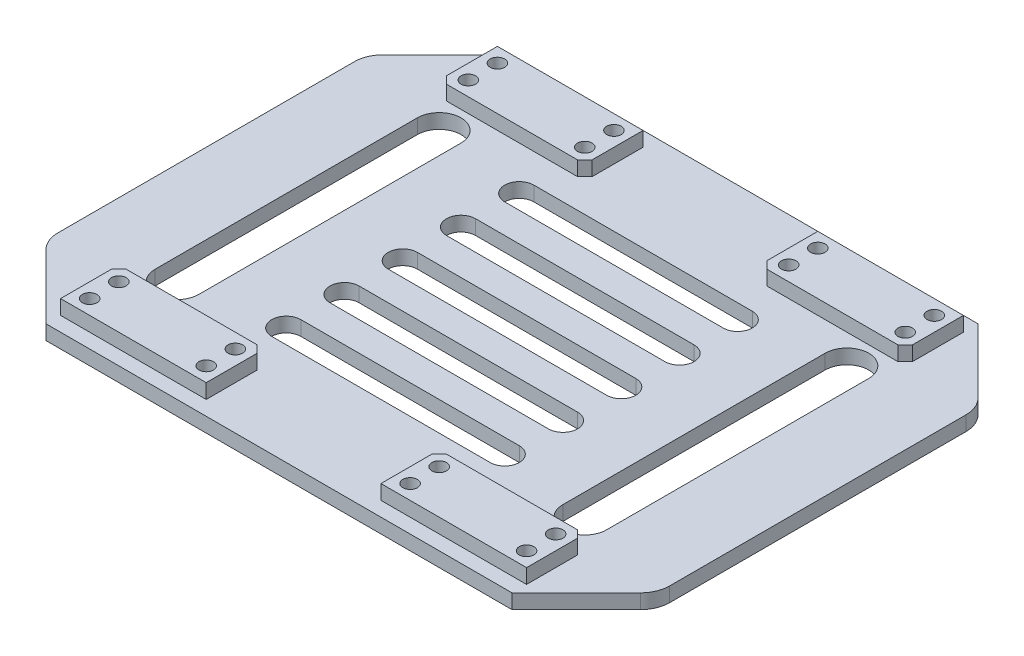
from build123d import *

# Parameters (mm, degrees)
SKETCH1_R               = 18.5
BOSS_EXTRUDE1_DEPTH     = 22.5
SKETCH2_R               = 1.6
CUT_EXTRUDE1_DEPTH      = 3.5
BOSS_EXTRUDE2_DEPTH     = 36.3
BOSS_EXTRUDE3_DEPTH     = 6.3
SKETCH4_R               = 14.5
BOSS_EXTRUDE4_DEPTH     = 37.8
SKETCH5_R               = 5
BOSS_EXTRUDE5_DEPTH     = 3
SKETCH6_R               = 1
BOSS_EXTRUDE6_DEPTH     = 9
SKETCH7_W               = 0.5
SKETCH7_H               = 3
BOSS_EXTRUDE7_DEPTH     = 6.5
CUT_EXTRUDE2_DEPTH      = 0.5
FILLET1_R               = 0.5
CHAMFER1_SIZE           = 0.2
CUT_EXTRUDE3_DEPTH      = 67.7078706
CUT_EXTRUDE3_DEPTH_BACK = 67.7078706
SKETCH9_R               = 1.6
SKETCH10_R              = 1.6
BOSS_EXTRUDE8_DEPTH     = 10
BOSS_EXTRUDE8_2_DEPTH   = 10
BOSS_EXTRUDE8_3_DEPTH   = 10
BOSS_EXTRUDE8_4_DEPTH   = 10
BOSS_EXTRUDE8_5_DEPTH   = 10
BOSS_EXTRUDE8_6_DEPTH   = 10
SKETCH11_W              = 50
SKETCH11_H              = 60
BOSS_EXTRUDE9_DEPTH     = 5
SKETCH13_W              = 56.82563108
SKETCH13_H              = 53.984349526
CUT_EXTRUDE4_DEPTH      = 121
CUT_EXTRUDE5_DEPTH      = 54.194830576
CUT_EXTRUDE5_DEPTH_BACK = 54.194830576
SKETCH14_R              = 1.6
SKETCH14_R_2            = 6
SKETCH15_W              = 160
SKETCH15_H              = 160
BOSS_EXTRUDE10_DEPTH    = 5
CHAMFER2_SIZE           = 2.5
CHAMFER3_SIZE           = 2.5
CUT_EXTRUDE6_DEPTH      = 237.127613802
SKETCH19_W              = 25
SKETCH19_H              = 160
BOSS_EXTRUDE11_DEPTH    = 5
CHAMFER4_SIZE           = 25
SKETCH20_R              = 12.5
SKETCH20_R_2            = 7.5
CUT_EXTRUDE7_DEPTH      = 10
CHAMFER5_SIZE           = 2.5
CHAMFER6_SIZE           = 2.5
FILLET2_R               = 10
BOSS_EXTRUDE12_START    = -5
SKETCH21_W              = 50
SKETCH21_H              = 20
SKETCH21_R              = 2.5
BOSS_EXTRUDE12_DEPTH    = 5
CHAMFER7_SIZE           = 2.5
SKETCH22_R              = 2.5
BOSS_EXTRUDE13_DEPTH    = 5
SKETCH23_W              = 231.350746522
SKETCH23_H              = 96.020227026
CUT_EXTRUDE8_DEPTH      = 212
SKETCH22_3_R            = 2.5
BOSS_EXTRUDE14_DEPTH    = 5
CUT_EXTRUDE9_DEPTH      = 243.757595144
CUT_EXTRUDE9_DEPTH_BACK = 243.757595144


with BuildPart() as part:
    # Sketch1 → Boss-Extrude1 (new body)
    with BuildSketch(Plane.XY):
        with Locations(Location((0, 0, 0), (0, 0, 180))):
            Circle(SKETCH1_R)
    extrude(amount=BOSS_EXTRUDE1_DEPTH)

    # Sketch2 → Cut-Extrude1 (cut)
    with BuildSketch(Plane.XY.offset(22.5)):
        with Locations((-7.75, 13.423393759)):
            Circle(SKETCH2_R)
        with Locations((7.75, 13.423393759)):
            Circle(SKETCH2_R)
        with Locations((-15.5, 0)):
            Circle(SKETCH2_R)
        with Locations((-7.75, -13.423393759)):
            Circle(SKETCH2_R)
        with Locations((7.75, -13.423393759)):
            Circle(SKETCH2_R)
        with Locations((15.5, 0)):
            Circle(SKETCH2_R)
    extrude(amount=-CUT_EXTRUDE1_DEPTH, mode=Mode.SUBTRACT)

    # Sketch3 → Boss-Extrude2 (add)
    with BuildSketch(Plane.XY.offset(22.5)):
        with BuildLine():
            ThreePointArc((0, 10), (-3, 7), (0, 4))
            Line((0, 4), (0, 10))
        make_face()
        with BuildLine():
            Line((0, 10), (0, 4))
            ThreePointArc((0, 4), (2.121320344, 4.878679656), (3, 7))
            ThreePointArc((3, 7), (2.121320344, 9.121320344), (0, 10))
        make_face()
    extrude(amount=BOSS_EXTRUDE2_DEPTH)

    # Sketch3<3> → Boss-Extrude3 (add)
    with BuildSketch(Plane.XY.offset(22.5)):
        with BuildLine():
            ThreePointArc((0, 13), (-6, 7), (0, 1))
            Line((0, 1), (0, 4))
            ThreePointArc((0, 4), (-3, 7), (0, 10))
            Line((0, 10), (0, 13))
        make_face()
        with BuildLine():
            Line((0, 4), (0, 1))
            ThreePointArc((0, 1), (4.242640687, 2.757359313), (6, 7))
            ThreePointArc((6, 7), (4.242640687, 11.242640687), (0, 13))
            Line((0, 13), (0, 10))
            ThreePointArc((0, 10), (2.121320344, 9.121320344), (3, 7))
            ThreePointArc((3, 7), (2.121320344, 4.878679656), (0, 4))
        make_face()
    extrude(amount=BOSS_EXTRUDE3_DEPTH)

    # Sketch4 → Boss-Extrude4 (add)
    with BuildSketch(Plane(origin=(0, 0, 0), x_dir=(-1, 0, 0), z_dir=(0, 0, -1))):
        with Locations(Location((0, 0, 0), (0, 0, 180))):
            Circle(SKETCH4_R)
    extrude(amount=BOSS_EXTRUDE4_DEPTH)

    # Sketch5 → Boss-Extrude5 (add)
    with BuildSketch(Plane(origin=(0, 0, -37.8), x_dir=(-1, 0, 0), z_dir=(0, 0, -1))):
        Circle(SKETCH5_R)
    extrude(amount=BOSS_EXTRUDE5_DEPTH)

    # Sketch6 → Boss-Extrude6 (add)
    with BuildSketch(Plane(origin=(0, 0, -40.8), x_dir=(-1, 0, 0), z_dir=(0, 0, -1))):
        Circle(SKETCH6_R)
    extrude(amount=BOSS_EXTRUDE6_DEPTH)

    # Sketch7 → Boss-Extrude7 (add)
    with BuildSketch(Plane(origin=(0, 0, -37.8), x_dir=(-1, 0, 0), z_dir=(0, 0, -1))):
        with Locations((-11.75, 0)):
            Rectangle(SKETCH7_W, SKETCH7_H)
        with Locations((11.75, 0)):
            Rectangle(SKETCH7_W, SKETCH7_H)
    extrude(amount=BOSS_EXTRUDE7_DEPTH)

    # Sketch8 → Cut-Extrude2 (cut)
    with BuildSketch(Plane(origin=(12, 0, 0), x_dir=(0, 0, -1), z_dir=(1, 0, 0))):
        with BuildLine():
            Line((42.865122037, -0.320114275), (41.665122037, -0.320114275))
            ThreePointArc((41.665122037, -0.320114275), (41.345007763, 0), (41.665122037, 0.320114275))
            Line((41.665122037, 0.320114275), (42.865122037, 0.320114275))
            ThreePointArc((42.865122037, 0.320114275), (43.185236312, 0), (42.865122037, -0.320114275))
        make_face()
    cut_extrude2 = extrude(amount=-CUT_EXTRUDE2_DEPTH, mode=Mode.SUBTRACT)

    # Mirror2: Cut-Extrude2 across plane
    add(cut_extrude2.mirror(Plane(origin=(0, 0, 0), x_dir=(0, 0, 1), z_dir=(1, 0, 0))), mode=Mode.SUBTRACT)

    # Fillet1
    fillet1_edges = [part.edges().sort_by_distance(p)[0] for p in [
        (11.75, -1.5, -44.3),
        (11.75, 1.5, -44.3),
        (-11.75, 1.5, -44.3),
        (-11.75, -1.5, -44.3),
    ]]
    fillet(fillet1_edges, radius=FILLET1_R)

    # Chamfer1
    chamfer1_edges = [part.edges().sort_by_distance(p)[0] for p in [
        (0, 4, 58.8),
        (0, 1, 28.8),
        (18.5, 0, 22.5),
    ]]
    chamfer(chamfer1_edges, length=CHAMFER1_SIZE)

    # Sketch9 → Cut-Extrude3 (cut, two sides: drawn at the far end of the back side and taken through both)
    with BuildSketch(Plane(origin=(0, 7, 0), x_dir=(1, 0, 0), z_dir=(0, 1, 0)).offset(-CUT_EXTRUDE3_DEPTH_BACK)):
        with Locations(Location((0, -50.8, 0), (0, 0, 270))):
            Circle(SKETCH9_R)
    extrude(amount=CUT_EXTRUDE3_DEPTH + CUT_EXTRUDE3_DEPTH_BACK, mode=Mode.SUBTRACT)



with BuildPart() as body_2:
    # Sketch10 → Boss-Extrude8 (new body)
    with BuildSketch(Plane.XY.offset(22.5)):
        with Locations((-7.75, 13.423393759)):
            Circle(SKETCH10_R)
    extrude(amount=BOSS_EXTRUDE8_DEPTH)


with BuildPart() as body_3:
    # Sketch10 → Boss-Extrude8 2 (new body)
    with BuildSketch(Plane.XY.offset(22.5)):
        with Locations((-15.5, 0)):
            Circle(SKETCH10_R)
    extrude(amount=BOSS_EXTRUDE8_2_DEPTH)


with BuildPart() as body_4:
    # Sketch10 → Boss-Extrude8 3 (new body)
    with BuildSketch(Plane.XY.offset(22.5)):
        with Locations((-7.75, -13.423393759)):
            Circle(SKETCH10_R)
    extrude(amount=BOSS_EXTRUDE8_3_DEPTH)


with BuildPart() as body_5:
    # Sketch10 → Boss-Extrude8 4 (new body)
    with BuildSketch(Plane.XY.offset(22.5)):
        with Locations((7.75, -13.423393759)):
            Circle(SKETCH10_R)
    extrude(amount=BOSS_EXTRUDE8_4_DEPTH)


with BuildPart() as body_6:
    # Sketch10 → Boss-Extrude8 5 (new body)
    with BuildSketch(Plane.XY.offset(22.5)):
        with Locations((15.5, 0)):
            Circle(SKETCH10_R)
    extrude(amount=BOSS_EXTRUDE8_5_DEPTH)


with BuildPart() as body_7:
    # Sketch10 → Boss-Extrude8 6 (new body)
    with BuildSketch(Plane.XY.offset(22.5)):
        with Locations((7.75, 13.423393759)):
            Circle(SKETCH10_R)
    extrude(amount=BOSS_EXTRUDE8_6_DEPTH)


with BuildPart() as part_1:
    add(part.part)

    add(body_2.part)  # Boss-Extrude9 merges body 2

    add(body_3.part)  # Boss-Extrude9 merges body 3

    add(body_4.part)  # Boss-Extrude9 merges body 4

    add(body_5.part)  # Boss-Extrude9 merges body 5

    add(body_6.part)  # Boss-Extrude9 merges body 6

    add(body_7.part)  # Boss-Extrude9 merges body 7
    # Sketch11 → Boss-Extrude9 (add)
    with BuildSketch(Plane.XY.offset(22.5)):
        with Locations((0, -5)):
            Rectangle(SKETCH11_W, SKETCH11_H)
    extrude(amount=BOSS_EXTRUDE9_DEPTH)

    # Sketch13 → Cut-Extrude4 (cut)
    with BuildSketch(Plane(origin=(0, 0, 22.5), x_dir=(-1, 0, 0), z_dir=(0, 0, -1))):
        with Locations((0.725433588, -0.664980789)):
            Rectangle(SKETCH13_W, SKETCH13_H)
    extrude(amount=CUT_EXTRUDE4_DEPTH, mode=Mode.SUBTRACT)

    # Sketch14 → Cut-Extrude5 (cut, two sides: drawn at the far end of the back side and taken through both)
    with BuildSketch(Plane.XY.offset(27.5).offset(-CUT_EXTRUDE5_DEPTH_BACK)):
        with Locations((-7.75, 13.423393759)):
            Circle(SKETCH14_R)
        with Locations((7.75, 13.423393759)):
            Circle(SKETCH14_R)
        with Locations((-15.5, 0)):
            Circle(SKETCH14_R)
        with Locations((-7.75, -13.423393759)):
            Circle(SKETCH14_R)
        with Locations((7.75, -13.423393759)):
            Circle(SKETCH14_R)
        with Locations((15.5, 0)):
            Circle(SKETCH14_R)
        with Locations((0, 7)):
            Circle(SKETCH14_R_2)
    extrude(amount=CUT_EXTRUDE5_DEPTH + CUT_EXTRUDE5_DEPTH_BACK, mode=Mode.SUBTRACT)

    # Sketch15 → Boss-Extrude10 (add)
    with BuildSketch(Plane(origin=(0, 25, 0), x_dir=(1, 0, 0), z_dir=(0, 1, 0))):
        with Locations((55, -102.5)):
            Rectangle(SKETCH15_W, SKETCH15_H)
    extrude(amount=BOSS_EXTRUDE10_DEPTH)

    # Mirror3: part across plane


with BuildPart() as part_2:
    add(part_1.part)
    add(part_1.part.mirror(Plane.XY.offset(102.5)))

    # Mirror11: part across plane


with BuildPart() as part_3:
    add(part_2.part)
    add(part_2.part.mirror(Plane(origin=(55, 0, 0), x_dir=(0, 0, 1), z_dir=(1, 0, 0))))

    # Chamfer2
    chamfer2_edges = [part_3.edges().sort_by_distance(p)[0] for p in [
        (25, 25, 25),
        (25, 25, 180),
        (85, 25, 25),
    ]]
    chamfer(chamfer2_edges, length=CHAMFER2_SIZE)

    # Chamfer3
    chamfer3_edges = [part_3.edges().sort_by_distance(p)[0] for p in [
        (85, 25, 180),
    ]]
    chamfer(chamfer3_edges, length=CHAMFER3_SIZE)

    # Sketch18 → Cut-Extrude6 (cut, through all)
    with BuildSketch(Plane(origin=(0, 30, 0), x_dir=(1, 0, 0), z_dir=(0, 1, 0))):
        with BuildLine():
            Line((92.5, -47.5), (17.5, -47.5))
            ThreePointArc((17.5, -47.5), (12.5, -42.5), (17.5, -37.5))
            Line((17.5, -37.5), (92.5, -37.5))
            ThreePointArc((92.5, -37.5), (97.5, -42.5), (92.5, -47.5))
        make_face()
        with BuildLine():
            Line((17.5, -57.5), (92.5, -57.5))
            ThreePointArc((92.5, -57.5), (97.5, -62.5), (92.5, -67.5))
            Line((92.5, -67.5), (17.5, -67.5))
            ThreePointArc((17.5, -67.5), (12.5, -62.5), (17.5, -57.5))
        make_face()
        with BuildLine():
            Line((17.5, -77.5), (92.5, -77.5))
            ThreePointArc((92.5, -77.5), (97.5, -82.5), (92.5, -87.5))
            Line((92.5, -87.5), (17.5, -87.5))
            ThreePointArc((17.5, -87.5), (12.5, -82.5), (17.5, -77.5))
        make_face()
        with BuildLine():
            Line((17.5, -97.5), (92.5, -97.5))
            ThreePointArc((92.5, -97.5), (97.5, -102.5), (92.5, -107.5))
            Line((92.5, -107.5), (17.5, -107.5))
            ThreePointArc((17.5, -107.5), (12.5, -102.5), (17.5, -97.5))
        make_face()
        with BuildLine():
            Line((17.5, -117.5), (92.5, -117.5))
            ThreePointArc((92.5, -117.5), (97.5, -122.5), (92.5, -127.5))
            Line((92.5, -127.5), (17.5, -127.5))
            ThreePointArc((17.5, -127.5), (12.5, -122.5), (17.5, -117.5))
        make_face()
        with BuildLine():
            Line((17.5, -137.5), (92.5, -137.5))
            ThreePointArc((92.5, -137.5), (97.5, -142.5), (92.5, -147.5))
            Line((92.5, -147.5), (17.5, -147.5))
            ThreePointArc((17.5, -147.5), (12.5, -142.5), (17.5, -137.5))
        make_face()
        with BuildLine():
            Line((92.5, -167.5), (17.5, -167.5))
            ThreePointArc((17.5, -167.5), (12.5, -162.5), (17.5, -157.5))
            Line((17.5, -157.5), (92.5, -157.5))
            ThreePointArc((92.5, -157.5), (97.5, -162.5), (92.5, -167.5))
        make_face()
    extrude(amount=-CUT_EXTRUDE6_DEPTH, mode=Mode.SUBTRACT)

    # Sketch19 → Boss-Extrude11 (add)
    with BuildSketch(Plane(origin=(0, 30, 0), x_dir=(1, 0, 0), z_dir=(0, 1, 0))):
        with Locations((-37.5, -102.5)):
            Rectangle(SKETCH19_W, SKETCH19_H)
        with Locations((147.5, -102.5)):
            Rectangle(SKETCH19_W, SKETCH19_H)
    extrude(amount=-BOSS_EXTRUDE11_DEPTH)

    # Chamfer4
    chamfer4_edges = [part_3.edges().sort_by_distance(p)[0] for p in [
        (-50, 27.5, 22.5),
        (-50, 27.5, 182.5),
        (160, 27.5, 182.5),
        (160, 27.5, 22.5),
    ]]
    chamfer(chamfer4_edges, length=CHAMFER4_SIZE)

    # Sketch20 → Cut-Extrude7 (cut)
    with BuildSketch(Plane(origin=(0, 30, 0), x_dir=(1, 0, 0), z_dir=(0, 1, 0))):
        with Locations(Location((130, -102.5, 0), (0, 0, 270))):
            Circle(SKETCH20_R)
        with Locations(Location((130, -62.5, 0), (0, 0, 270))):
            Circle(SKETCH20_R_2)
        with Locations(Location((130, -142.5, 0), (0, 0, 270))):
            Circle(SKETCH20_R_2)
        with Locations(Location((-20, -142.5, 0), (0, 0, 270))):
            Circle(SKETCH20_R_2)
        with Locations(Location((-20, -102.5, 0), (0, 0, 270))):
            Circle(SKETCH20_R)
        with Locations(Location((-20, -62.5, 0), (0, 0, 270))):
            Circle(SKETCH20_R_2)
    extrude(amount=-CUT_EXTRUDE7_DEPTH, mode=Mode.SUBTRACT)

    # Chamfer5
    chamfer5_edges = [part_3.edges().sort_by_distance(p)[0] for p in [
        (108.75, 25, 177.5),
        (1.25, 25, 177.5),
        (1.25, 25, 27.5),
        (108.75, 25, 27.5),
    ]]
    chamfer(chamfer5_edges, length=CHAMFER5_SIZE)

    # Chamfer6
    chamfer6_edges = [part_3.edges().sort_by_distance(p)[0] for p in [
        (135, 25, 178.75),
        (135, 25, 26.25),
        (-25, 25, 26.25),
        (-25, 25, 178.75),
    ]]
    chamfer(chamfer6_edges, length=CHAMFER6_SIZE)

    # Fillet2
    fillet2_edges = [part_3.edges().sort_by_distance(p)[0] for p in [
        (-50, 27.5, 157.5),
        (-50, 27.5, 47.5),
        (160, 27.5, 47.5),
        (160, 27.5, 157.5),
    ]]
    fillet(fillet2_edges, radius=FILLET2_R)

    # Sketch21 → Boss-Extrude12 (add)
    # profile 1 of 4: a face of its own
    with BuildSketch(Plane.XZ.offset(35).offset(BOSS_EXTRUDE12_START)):
        with Locations((110, 37.5)):
            Rectangle(SKETCH21_W, SKETCH21_H)
        with Locations(Location((90, 32.5, 0), (0, 0, 270))):
            Circle(SKETCH21_R, mode=Mode.SUBTRACT)
        with Locations(Location((90, 42.5, 0), (0, 0, 270))):
            Circle(SKETCH21_R, mode=Mode.SUBTRACT)
        with Locations(Location((130, 32.5, 0), (0, 0, 90))):
            Circle(SKETCH21_R, mode=Mode.SUBTRACT)
        with Locations(Location((130, 42.5, 0), (0, 0, 90))):
            Circle(SKETCH21_R, mode=Mode.SUBTRACT)
    # profile 2 of 4: a face of its own
    with BuildSketch(Plane.XZ.offset(35).offset(BOSS_EXTRUDE12_START)):
        with Locations((110, 167.5)):
            Rectangle(SKETCH21_W, SKETCH21_H)
        with Locations(Location((90, 162.5, 0), (0, 0, 90))):
            Circle(SKETCH21_R, mode=Mode.SUBTRACT)
        with Locations(Location((90, 172.5, 0), (0, 0, 90))):
            Circle(SKETCH21_R, mode=Mode.SUBTRACT)
        with Locations(Location((130, 172.5, 0), (0, 0, 270))):
            Circle(SKETCH21_R, mode=Mode.SUBTRACT)
        with Locations(Location((130, 162.5, 0), (0, 0, 270))):
            Circle(SKETCH21_R, mode=Mode.SUBTRACT)
    # profile 3 of 4: a face of its own
    with BuildSketch(Plane.XZ.offset(35).offset(BOSS_EXTRUDE12_START)):
        with Locations((0, 167.5)):
            Rectangle(SKETCH21_W, SKETCH21_H)
        with Locations(Location((-20, 162.5, 0), (0, 0, 90))):
            Circle(SKETCH21_R, mode=Mode.SUBTRACT)
        with Locations(Location((-20, 172.5, 0), (0, 0, 90))):
            Circle(SKETCH21_R, mode=Mode.SUBTRACT)
        with Locations(Location((20, 172.5, 0), (0, 0, 270))):
            Circle(SKETCH21_R, mode=Mode.SUBTRACT)
        with Locations(Location((20, 162.5, 0), (0, 0, 270))):
            Circle(SKETCH21_R, mode=Mode.SUBTRACT)
    # profile 4 of 4: a face of its own
    with BuildSketch(Plane.XZ.offset(35).offset(BOSS_EXTRUDE12_START)):
        with Locations((0, 37.5)):
            Rectangle(SKETCH21_W, SKETCH21_H)
        with Locations(Location((-20, 32.5, 0), (0, 0, 270))):
            Circle(SKETCH21_R, mode=Mode.SUBTRACT)
        with Locations(Location((-20, 42.5, 0), (0, 0, 270))):
            Circle(SKETCH21_R, mode=Mode.SUBTRACT)
        with Locations(Location((20, 32.5, 0), (0, 0, 90))):
            Circle(SKETCH21_R, mode=Mode.SUBTRACT)
        with Locations(Location((20, 42.5, 0), (0, 0, 90))):
            Circle(SKETCH21_R, mode=Mode.SUBTRACT)
    extrude(amount=-BOSS_EXTRUDE12_DEPTH)

    # Chamfer7
    chamfer7_edges = [part_3.edges().sort_by_distance(p)[0] for p in [
        (85, -27.5, 47.5),
        (135, -27.5, 47.5),
        (85, -27.5, 157.5),
        (135, -27.5, 157.5),
        (25, -27.5, 157.5),
        (-25, -27.5, 157.5),
        (-25, -27.5, 47.5),
        (25, -27.5, 47.5),
    ]]
    chamfer(chamfer7_edges, length=CHAMFER7_SIZE)

    # Sketch23 → Cut-Extrude8 (cut)
    with BuildSketch(Plane(origin=(0, 0, 22.5), x_dir=(-1, 0, 0), z_dir=(0, 0, -1))):
        with Locations((-44.324626739, 13.010113513)):
            Rectangle(SKETCH23_W, SKETCH23_H)
    extrude(amount=-CUT_EXTRUDE8_DEPTH, mode=Mode.SUBTRACT)


with BuildPart() as body_2_2:
    # Sketch22 → Boss-Extrude13 (new body)
    with BuildSketch(Plane.XZ.offset(35)):
        with BuildLine():
            Line((-25, 182.5), (-47.071067812, 160.428932188))
            ThreePointArc((-47.071067812, 160.428932188), (-49.238795325, 157.1846987), (-50, 153.357864376))
            Line((-50, 153.357864376), (-50, 51.642135624))
            ThreePointArc((-50, 51.642135624), (-49.238795325, 47.8153013), (-47.071067812, 44.571067812))
            Line((-47.071067812, 44.571067812), (-25, 22.5))
            Line((-25, 22.5), (135, 22.5))
            Line((135, 22.5), (157.071067812, 44.571067812))
            ThreePointArc((157.071067812, 44.571067812), (159.238795325, 47.8153013), (160, 51.642135624))
            Line((160, 51.642135624), (160, 153.357864376))
            ThreePointArc((160, 153.357864376), (159.238795325, 157.1846987), (157.071067812, 160.428932188))
            Line((157.071067812, 160.428932188), (135, 182.5))
            Line((135, 182.5), (-25, 182.5))
        make_face()
        with Locations(Location((-20, 32.5, 0), (0, 0, 270))):
            Circle(SKETCH22_R, mode=Mode.SUBTRACT)
        with Locations(Location((-20, 42.5, 0), (0, 0, 270))):
            Circle(SKETCH22_R, mode=Mode.SUBTRACT)
        with Locations(Location((20, 32.5, 0), (0, 0, 270))):
            Circle(SKETCH22_R, mode=Mode.SUBTRACT)
        with Locations(Location((20, 42.5, 0), (0, 0, 270))):
            Circle(SKETCH22_R, mode=Mode.SUBTRACT)
        with Locations(Location((90, 32.5, 0), (0, 0, 270))):
            Circle(SKETCH22_R, mode=Mode.SUBTRACT)
        with Locations(Location((90, 42.5, 0), (0, 0, 270))):
            Circle(SKETCH22_R, mode=Mode.SUBTRACT)
        with Locations(Location((130, 32.5, 0), (0, 0, 270))):
            Circle(SKETCH22_R, mode=Mode.SUBTRACT)
        with Locations(Location((130, 42.5, 0), (0, 0, 270))):
            Circle(SKETCH22_R, mode=Mode.SUBTRACT)
        with Locations(Location((-20, 162.5, 0), (0, 0, 270))):
            Circle(SKETCH22_R, mode=Mode.SUBTRACT)
        with Locations(Location((-20, 172.5, 0), (0, 0, 270))):
            Circle(SKETCH22_R, mode=Mode.SUBTRACT)
        with Locations(Location((20, 162.5, 0), (0, 0, 270))):
            Circle(SKETCH22_R, mode=Mode.SUBTRACT)
        with Locations(Location((20, 172.5, 0), (0, 0, 270))):
            Circle(SKETCH22_R, mode=Mode.SUBTRACT)
        with Locations(Location((90, 162.5, 0), (0, 0, 270))):
            Circle(SKETCH22_R, mode=Mode.SUBTRACT)
        with Locations(Location((90, 172.5, 0), (0, 0, 270))):
            Circle(SKETCH22_R, mode=Mode.SUBTRACT)
        with Locations(Location((130, 162.5, 0), (0, 0, 270))):
            Circle(SKETCH22_R, mode=Mode.SUBTRACT)
        with Locations(Location((130, 172.5, 0), (0, 0, 270))):
            Circle(SKETCH22_R, mode=Mode.SUBTRACT)
    extrude(amount=BOSS_EXTRUDE13_DEPTH)

    # Sketch22<3> → Boss-Extrude14 (add)
    # profile 1 of 4: a face of its own
    with BuildSketch(Plane.XZ.offset(35)):
        Polygon((135, 27.5), (135, 45), (132.5, 47.5), (87.5, 47.5), (85, 45), (85, 27.5), align=None)
        with Locations(Location((90, 42.5, 0), (0, 0, 270))):
            Circle(SKETCH22_3_R, mode=Mode.SUBTRACT)
        with Locations(Location((90, 32.5, 0), (0, 0, 270))):
            Circle(SKETCH22_3_R, mode=Mode.SUBTRACT)
        with Locations(Location((130, 32.5, 0), (0, 0, 270))):
            Circle(SKETCH22_3_R, mode=Mode.SUBTRACT)
        with Locations(Location((130, 42.5, 0), (0, 0, 270))):
            Circle(SKETCH22_3_R, mode=Mode.SUBTRACT)
    # profile 2 of 4: a face of its own
    with BuildSketch(Plane.XZ.offset(35)):
        Polygon((-25, 45), (-25, 27.5), (25, 27.5), (25, 45), (22.5, 47.5), (-22.5, 47.5), align=None)
        with Locations(Location((-20, 42.5, 0), (0, 0, 270))):
            Circle(SKETCH22_3_R, mode=Mode.SUBTRACT)
        with Locations(Location((-20, 32.5, 0), (0, 0, 270))):
            Circle(SKETCH22_3_R, mode=Mode.SUBTRACT)
        with Locations(Location((20, 32.5, 0), (0, 0, 270))):
            Circle(SKETCH22_3_R, mode=Mode.SUBTRACT)
        with Locations(Location((20, 42.5, 0), (0, 0, 270))):
            Circle(SKETCH22_3_R, mode=Mode.SUBTRACT)
    # profile 3 of 4: a face of its own
    with BuildSketch(Plane.XZ.offset(35)):
        Polygon((132.5, 157.5), (135, 160), (135, 177.5), (85, 177.5), (85, 160), (87.5, 157.5), align=None)
        with Locations(Location((90, 172.5, 0), (0, 0, 270))):
            Circle(SKETCH22_3_R, mode=Mode.SUBTRACT)
        with Locations(Location((90, 162.5, 0), (0, 0, 270))):
            Circle(SKETCH22_3_R, mode=Mode.SUBTRACT)
        with Locations(Location((130, 172.5, 0), (0, 0, 270))):
            Circle(SKETCH22_3_R, mode=Mode.SUBTRACT)
        with Locations(Location((130, 162.5, 0), (0, 0, 270))):
            Circle(SKETCH22_3_R, mode=Mode.SUBTRACT)
    # profile 4 of 4: a face of its own
    with BuildSketch(Plane.XZ.offset(35)):
        Polygon((-25, 177.5), (-25, 160), (-22.5, 157.5), (22.5, 157.5), (25, 160), (25, 177.5), align=None)
        with Locations(Location((20, 162.5, 0), (0, 0, 270))):
            Circle(SKETCH22_3_R, mode=Mode.SUBTRACT)
        with Locations(Location((-20, 162.5, 0), (0, 0, 270))):
            Circle(SKETCH22_3_R, mode=Mode.SUBTRACT)
        with Locations(Location((-20, 172.5, 0), (0, 0, 270))):
            Circle(SKETCH22_3_R, mode=Mode.SUBTRACT)
        with Locations(Location((20, 172.5, 0), (0, 0, 270))):
            Circle(SKETCH22_3_R, mode=Mode.SUBTRACT)
    extrude(amount=-BOSS_EXTRUDE14_DEPTH)

    # Sketch24 → Cut-Extrude9 (cut, two sides: drawn at the far end of the back side and taken through both)
    with BuildSketch(Plane(origin=(0, -35, 0), x_dir=(1, 0, 0), z_dir=(0, 1, 0)).offset(-CUT_EXTRUDE9_DEPTH_BACK)):
        with BuildLine():
            Line((17.5, -57.5), (92.5, -57.5))
            ThreePointArc((92.5, -57.5), (97.5, -62.5), (92.5, -67.5))
            Line((92.5, -67.5), (17.5, -67.5))
            ThreePointArc((17.5, -67.5), (12.5, -62.5), (17.5, -57.5))
        make_face()
        with BuildLine():
            Line((92.5, -87.5), (17.5, -87.5))
            ThreePointArc((17.5, -87.5), (12.5, -82.5), (17.5, -77.5))
            Line((17.5, -77.5), (92.5, -77.5))
            ThreePointArc((92.5, -77.5), (97.5, -82.5), (92.5, -87.5))
        make_face()
        with BuildLine():
            Line((17.5, -97.5), (92.5, -97.5))
            ThreePointArc((92.5, -97.5), (97.5, -102.5), (92.5, -107.5))
            Line((92.5, -107.5), (17.5, -107.5))
            ThreePointArc((17.5, -107.5), (12.5, -102.5), (17.5, -97.5))
        make_face()
        with BuildLine():
            Line((92.5, -127.5), (17.5, -127.5))
            ThreePointArc((17.5, -127.5), (12.5, -122.5), (17.5, -117.5))
            Line((17.5, -117.5), (92.5, -117.5))
            ThreePointArc((92.5, -117.5), (97.5, -122.5), (92.5, -127.5))
        make_face()
        with BuildLine():
            Line((17.5, -137.5), (92.5, -137.5))
            ThreePointArc((92.5, -137.5), (97.5, -142.5), (92.5, -147.5))
            Line((92.5, -147.5), (17.5, -147.5))
            ThreePointArc((17.5, -147.5), (12.5, -142.5), (17.5, -137.5))
        make_face()
        with BuildLine():
            Line((-7.5, -57.5), (-7.5, -147.5))
            ThreePointArc((-7.5, -147.5), (-15, -155), (-22.5, -147.5))
            Line((-22.5, -147.5), (-22.5, -57.5))
            ThreePointArc((-22.5, -57.5), (-15, -50), (-7.5, -57.5))
        make_face()
        with BuildLine():
            Line((132.5, -57.5), (132.5, -147.5))
            ThreePointArc((132.5, -147.5), (125, -155), (117.5, -147.5))
            Line((117.5, -147.5), (117.5, -57.5))
            ThreePointArc((117.5, -57.5), (125, -50), (132.5, -57.5))
        make_face()
    extrude(amount=CUT_EXTRUDE9_DEPTH + CUT_EXTRUDE9_DEPTH_BACK, mode=Mode.SUBTRACT)


solid = body_2_2.part
